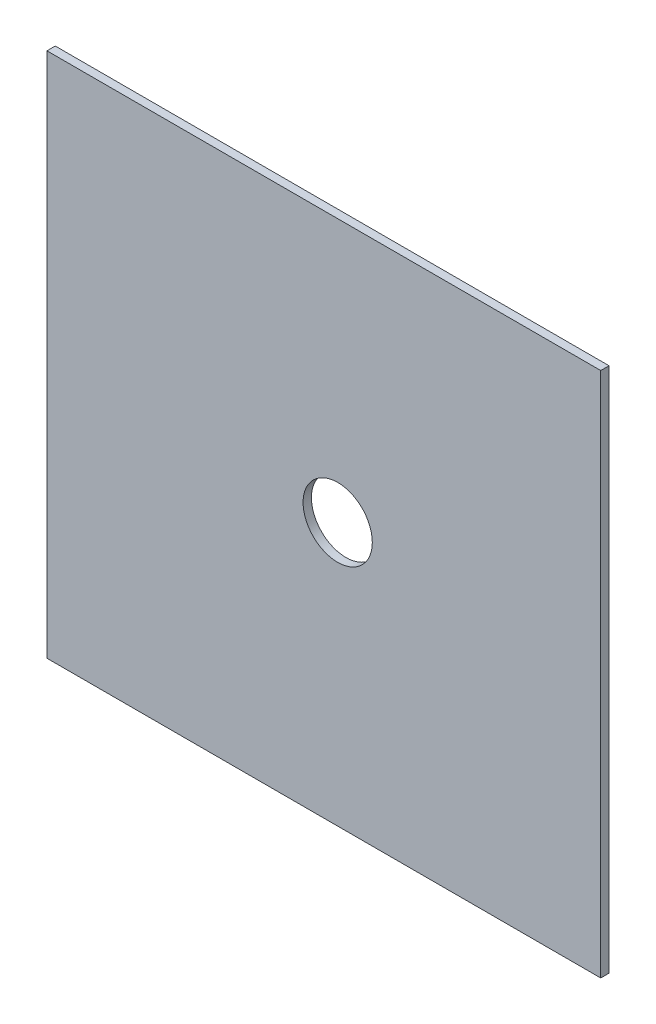
from build123d import *

# Parameters (mm, degrees)
CROQUIS1_W              = 200
CROQUIS1_H              = 190
SALIENTE_EXTRUIR1_DEPTH = 3
CROQUIS2_R              = 12.5
CORTAR_EXTRUIR1_DEPTH   = 3


with BuildPart() as part:
    # Croquis1 → Saliente-Extruir1 (new body)
    with BuildSketch(Plane.XY):
        Rectangle(CROQUIS1_W, CROQUIS1_H)
    extrude(amount=SALIENTE_EXTRUIR1_DEPTH)

    # Croquis2 → Cortar-Extruir1 (cut)
    with BuildSketch(Plane.XY.offset(3)):
        with Locations((5, 0)):
            Circle(CROQUIS2_R)
    extrude(amount=-CORTAR_EXTRUIR1_DEPTH, mode=Mode.SUBTRACT)


solid = part.part
